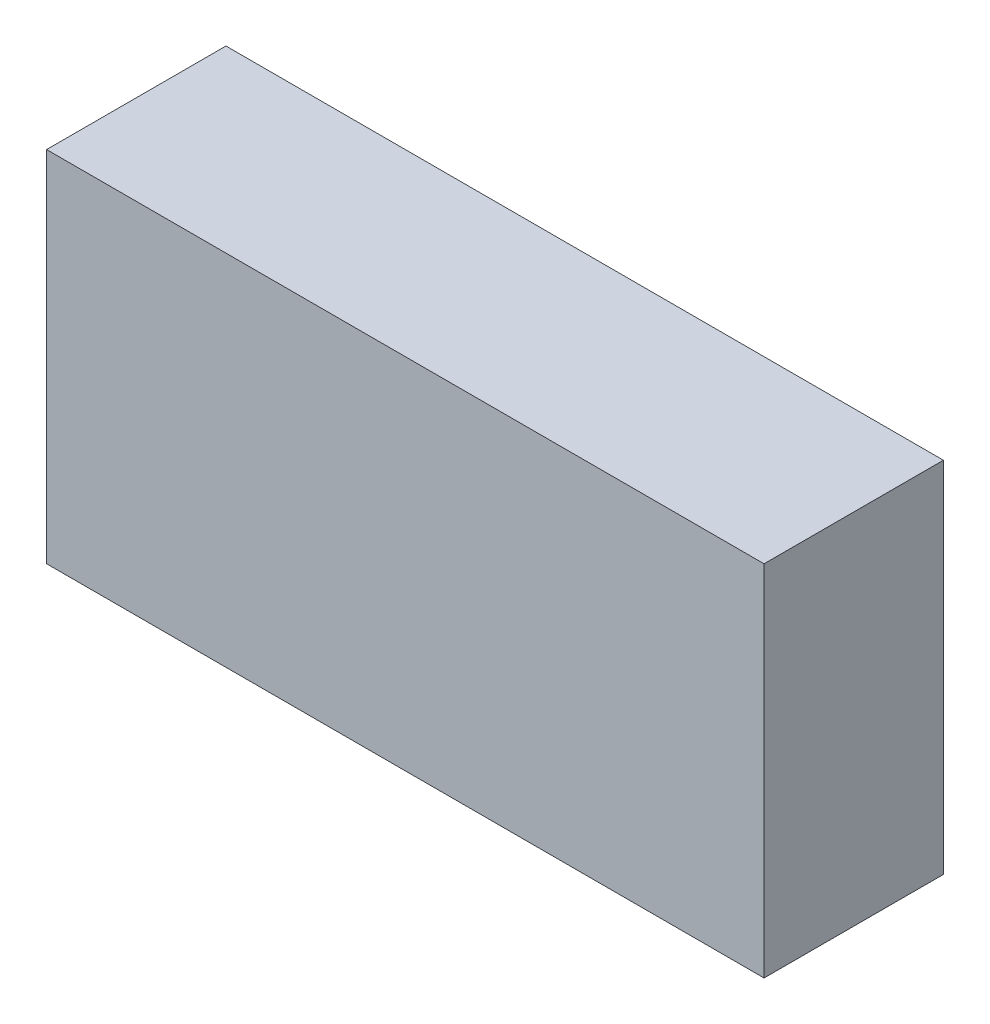
from build123d import *

# Parameters (mm, degrees)
RECTANGLESKETCH_W = 40
RECTANGLESKETCH_H = 20
BLINDBOSS_DEPTH   = 10


with BuildPart() as part:
    # RectangleSketch → BlindBoss (new body)
    with BuildSketch(Plane.XY):
        with Locations((20, 10)):
            Rectangle(RECTANGLESKETCH_W, RECTANGLESKETCH_H)
    extrude(amount=BLINDBOSS_DEPTH)


solid = part.part
